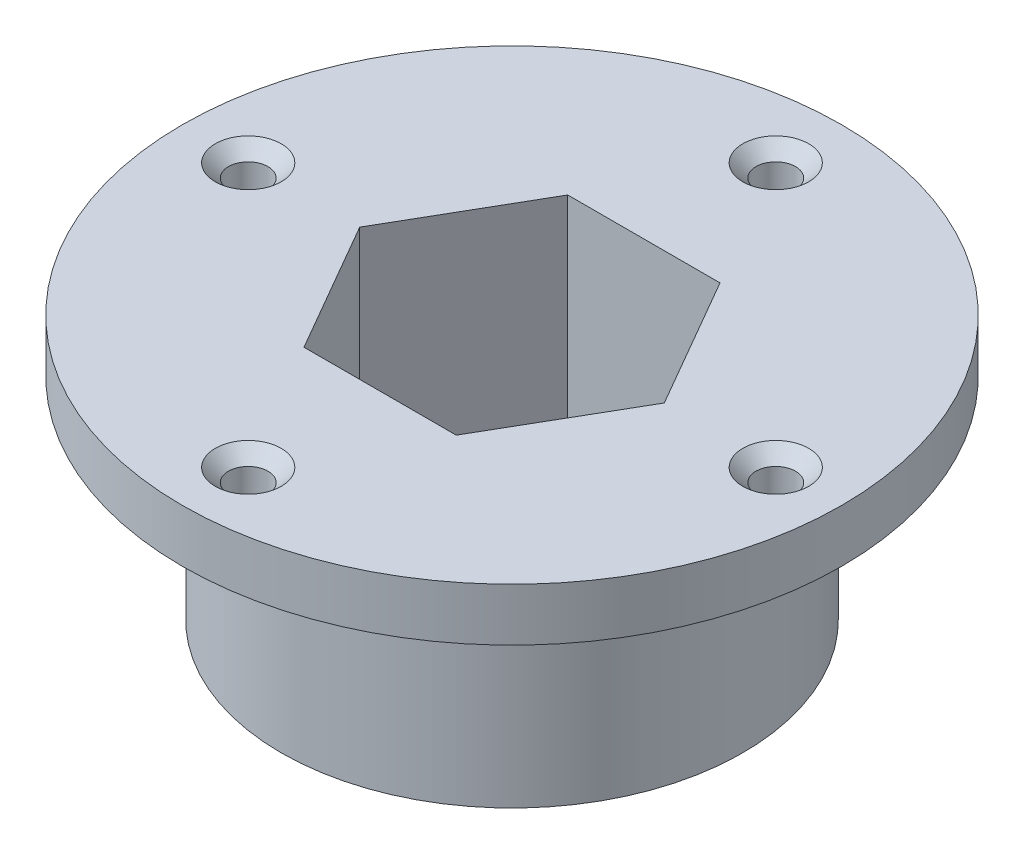
from build123d import *

# Parameters (mm, degrees)
SKETCH1_R           = 17.5
BOSS_EXTRUDE1_DEPTH = 16
SKETCH2_R           = 25
SKETCH2_R_2         = 12.5
BOSS_EXTRUDE2_DEPTH = 4
SKETCH3_R           = 1.5
CUT_EXTRUDE1_DEPTH  = 41.620192023
CHAMFER1_SIZE       = 1
SKETCH4_R           = 12.5
BOSS_EXTRUDE3_DEPTH = 4


with BuildPart() as part:
    # Sketch1 → Boss-Extrude1 (new body)
    with BuildSketch(Plane(origin=(0, 0, 0), x_dir=(1, 0, 0), z_dir=(0, 1, 0))):
        with Locations(Location((0, 0, 0), (0, 0, 270))):
            Circle(SKETCH1_R)
        Polygon((5.773502692, -10), (11.547005384, 0), (5.773502692, 10), (-5.773502692, 10), (-11.547005384, 0), (-5.773502692, -10), align=None, mode=Mode.SUBTRACT)
    extrude(amount=BOSS_EXTRUDE1_DEPTH)

    # Sketch2 → Boss-Extrude2 (add)
    with BuildSketch(Plane(origin=(0, 16, 0), x_dir=(1, 0, 0), z_dir=(0, 1, 0))):
        with Locations(Location((0, 0, 0), (0, 0, 270))):
            Circle(SKETCH2_R)
        with Locations(Location((0, 0, 0), (0, 0, 270))):
            Circle(SKETCH2_R_2, mode=Mode.SUBTRACT)
    extrude(amount=BOSS_EXTRUDE2_DEPTH)

    # Sketch3 → Cut-Extrude1 (cut, through all)
    with BuildSketch(Plane(origin=(0, 20, 0), x_dir=(1, 0, 0), z_dir=(0, 1, 0))):
        with Locations(Location((0, 20, 0), (0, 0, 270))):
            Circle(SKETCH3_R)
        with Locations(Location((20, 0, 0), (0, 0, 270))):
            Circle(SKETCH3_R)
        with Locations(Location((0, -20, 0), (0, 0, 270))):
            Circle(SKETCH3_R)
        with Locations(Location((-20, 0, 0), (0, 0, 270))):
            Circle(SKETCH3_R)
    extrude(amount=-CUT_EXTRUDE1_DEPTH, mode=Mode.SUBTRACT)

    # Chamfer1
    chamfer1_edges = [part.edges().sort_by_distance(p)[0] for p in [
        (0, 20, -21.5),
        (20, 20, -1.5),
        (0, 20, 18.5),
        (-20, 20, -1.5),
    ]]
    chamfer(chamfer1_edges, length=CHAMFER1_SIZE)

    # Sketch4 → Boss-Extrude3 (add)
    with BuildSketch(Plane(origin=(0, 16, 0), x_dir=(1, 0, 0), z_dir=(0, 1, 0))):
        Circle(SKETCH4_R)
        Polygon((-5.773502692, -10), (5.773502692, -10), (11.547005384, 0), (5.773502692, 10), (-5.773502692, 10), (-11.547005384, 0), align=None, mode=Mode.SUBTRACT)
    extrude(amount=BOSS_EXTRUDE3_DEPTH)


solid = part.part
